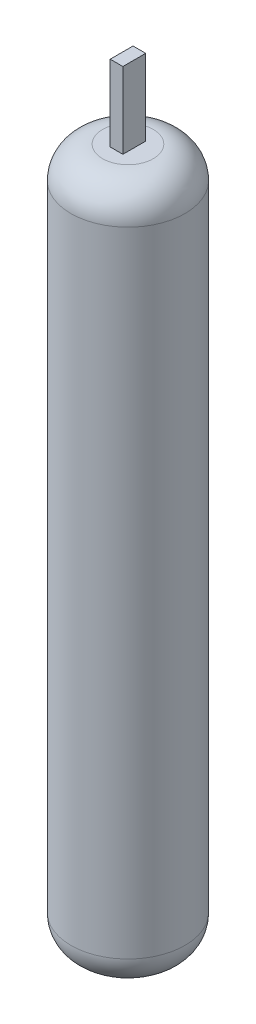
from build123d import *

# Parameters (mm, degrees)
SKETCH1_R           = 4.5
BOSS_EXTRUDE1_DEPTH = 55
SKETCH2_W           = 1
SKETCH2_H           = 1.8
BOSS_EXTRUDE2_DEPTH = 6
SKETCH3_W           = 1.2
SKETCH3_H           = 2
CUT_EXTRUDE1_DEPTH  = 6
FILLET1_R           = 2.5


with BuildPart() as part:
    # Sketch1 → Boss-Extrude1 (new body)
    with BuildSketch(Plane(origin=(0, 0, 0), x_dir=(1, 0, 0), z_dir=(0, 1, 0))):
        with Locations(Location((0, 0, 0), (0, 0, 270))):
            Circle(SKETCH1_R)
    extrude(amount=BOSS_EXTRUDE1_DEPTH)

    # Sketch2 → Boss-Extrude2 (add)
    with BuildSketch(Plane(origin=(0, 55, 0), x_dir=(1, 0, 0), z_dir=(0, 1, 0))):
        Rectangle(SKETCH2_W, SKETCH2_H)
    extrude(amount=BOSS_EXTRUDE2_DEPTH)

    # Sketch3 → Cut-Extrude1 (cut)
    with BuildSketch(Plane.XZ):
        Rectangle(SKETCH3_W, SKETCH3_H)
    extrude(amount=-CUT_EXTRUDE1_DEPTH, mode=Mode.SUBTRACT)

    # Fillet1
    fillet1_edges = [part.edges().sort_by_distance(p)[0] for p in [
        (0, 0, -4.5),
        (0, 55, -4.5),
    ]]
    fillet(fillet1_edges, radius=FILLET1_R)


solid = part.part
